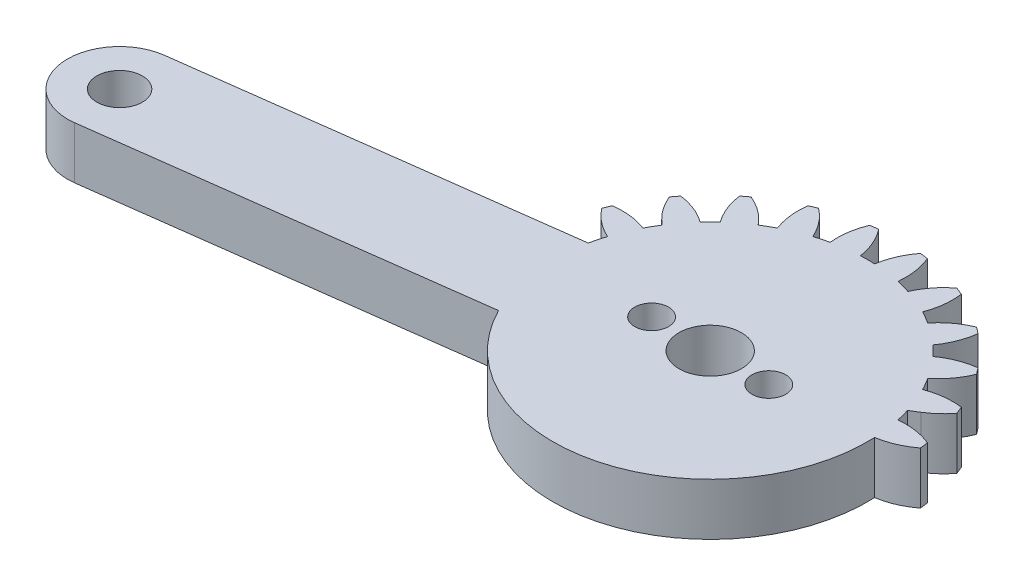
from build123d import *

# Parameters (mm, degrees)
SKETCH1_R           = 1.75
SKETCH1_R_2         = 2.4
SKETCH1_R_3         = 1.3
BOSS_EXTRUDE1_DEPTH = 4


with BuildPart() as part:
    # Sketch1 → Boss-Extrude1 (new body)
    with BuildSketch(Plane(origin=(0, 4, 0), x_dir=(1, 0, 0), z_dir=(0, 1, 0))):
        with BuildLine():
            Line((1.43808022, 3.600125745), (2.081641936, 4))
            ThreePointArc((2.081641936, 4), (2.861028333, 4.588201733), (3.521749436, 5.30713988))
            ThreePointArc((3.521749436, 5.30713988), (3.405395609, 5.596745198), (3.282888305, 5.883801663))
            ThreePointArc((3.282888305, 5.883801663), (1.93527598, 5.894040025), (0.627094961, 5.57027124))
            ThreePointArc((0.627094961, 5.57027124), (0.366286148, 6.046375), (0.084372603, 6.510293938))
            ThreePointArc((0.084372603, 6.510293938), (1.018855105, 7.48132754), (1.683794586, 8.65351323))
            ThreePointArc((1.683794586, 8.65351323), (1.496450048, 8.903135899), (1.303821399, 9.148703928))
            ThreePointArc((1.303821399, 9.148703928), (-0.000522033, 8.809805691), (-1.180330337, 8.158486898))
            ThreePointArc((-1.180330337, 8.158486898), (-1.555477026, 8.550865528), (-1.947855656, 8.926012217))
            ThreePointArc((-1.947855656, 8.926012217), (-1.296536862, 10.105820521), (-0.957638625, 11.410163953))
            ThreePointArc((-0.957638625, 11.410163953), (-1.203206655, 11.602792602), (-1.452829324, 11.79013714))
            ThreePointArc((-1.452829324, 11.79013714), (-2.625015014, 11.125197659), (-3.596048616, 10.190715157))
            ThreePointArc((-3.596048616, 10.190715157), (-4.059967554, 10.472628702), (-4.536071314, 10.733437515))
            ThreePointArc((-4.536071314, 10.733437515), (-4.212302529, 12.041618533), (-4.222540891, 13.389230859))
            ThreePointArc((-4.222540891, 13.389230859), (-4.509597355, 13.511738163), (-4.799202674, 13.62809199))
            ThreePointArc((-4.799202674, 13.62809199), (-5.759348103, 12.682425791), (-6.455432668, 11.528463019))
            ThreePointArc((-6.455432668, 11.528463019), (-6.976508546, 11.680699536), (-7.503891752, 11.809396783))
            ThreePointArc((-7.503891752, 11.809396783), (-7.529737283, 13.156800143), (-7.888414517, 14.455843809))
            ThreePointArc((-7.888414517, 14.455843809), (-8.197396993, 14.499881098), (-8.507248835, 14.537314892))
            ThreePointArc((-8.507248835, 14.537314892), (-9.18992168, 13.375367565), (-9.563620196, 12.080565177))
            ThreePointArc((-9.563620196, 12.080565177), (-10.106342554, 12.09275), (-10.649064912, 12.080565177))
            ThreePointArc((-10.649064912, 12.080565177), (-11.022763428, 13.375367565), (-11.705436272, 14.537314892))
            ThreePointArc((-11.705436272, 14.537314892), (-12.015288115, 14.499881098), (-12.324270591, 14.455843809))
            ThreePointArc((-12.324270591, 14.455843809), (-12.682947825, 13.156800143), (-12.708793355, 11.809396783))
            ThreePointArc((-12.708793355, 11.809396783), (-13.236176561, 11.680699536), (-13.757252439, 11.528463019))
            ThreePointArc((-13.757252439, 11.528463019), (-14.453337005, 12.682425791), (-15.413482434, 13.62809199))
            ThreePointArc((-15.413482434, 13.62809199), (-15.703087752, 13.511738163), (-15.990144217, 13.389230859))
            ThreePointArc((-15.990144217, 13.389230859), (-16.000382579, 12.041618533), (-15.676613793, 10.733437515))
            ThreePointArc((-15.676613793, 10.733437515), (-16.152717554, 10.472628702), (-16.616636492, 10.190715157))
            ThreePointArc((-16.616636492, 10.190715157), (-17.587670094, 11.125197659), (-18.759855783, 11.79013714))
            ThreePointArc((-18.759855783, 11.79013714), (-19.009478453, 11.602792602), (-19.255046482, 11.410163953))
            ThreePointArc((-19.255046482, 11.410163953), (-18.916148245, 10.105820521), (-18.264829452, 8.926012217))
            ThreePointArc((-18.264829452, 8.926012217), (-18.657208082, 8.550865528), (-19.032354771, 8.158486898))
            ThreePointArc((-19.032354771, 8.158486898), (-20.212163074, 8.809805691), (-21.516506507, 9.148703928))
            ThreePointArc((-21.516506507, 9.148703928), (-21.709135156, 8.903135899), (-21.896479694, 8.65351323))
            ThreePointArc((-21.896479694, 8.65351323), (-21.231540213, 7.48132754), (-20.297057711, 6.510293938))
            ThreePointArc((-20.297057711, 6.510293938), (-20.578971255, 6.046375), (-20.839780068, 5.57027124))
            ThreePointArc((-20.839780068, 5.57027124), (-22.147961087, 5.894040025), (-23.495573413, 5.883801663))
            ThreePointArc((-23.495573413, 5.883801663), (-23.618080717, 5.596745198), (-23.734434544, 5.30713988))
            ThreePointArc((-23.734434544, 5.30713988), (-22.788768345, 4.346994451), (-21.634805572, 3.650909885))
            ThreePointArc((-21.634805572, 3.650909885), (-21.803584999, 3.067429176), (-21.942853375, 2.47620963))
            Line((-21.942853375, 2.47620963), (-50.694754355, -1.309049944))
            ThreePointArc((-50.694754355, -1.309049944), (-54.138429032, -5.796934159), (-49.650544818, -9.240608835))
            Line((-49.650544818, -9.240608835), (-20.898643838, -5.455349261))
            ThreePointArc((-20.898643838, -5.455349261), (-7.038913378, -11.697242445), (1.974222624, 0.542722358))
            ThreePointArc((1.974222624, 0.542722358), (3.269025011, 0.916420874), (4.430972339, 1.599093719))
            ThreePointArc((4.430972339, 1.599093719), (4.393538544, 1.908945561), (4.349501255, 2.217928037))
            ThreePointArc((4.349501255, 2.217928037), (3.050457589, 2.576605271), (1.70305423, 2.602450802))
            ThreePointArc((1.70305423, 2.602450802), (1.581217534, 3.104116905), (1.43808022, 3.600125745))
        make_face()
        with Locations(Location((-50.172649586, -5.27482939, 0), (0, 0, 90))):
            Circle(SKETCH1_R, mode=Mode.SUBTRACT)
        with Locations(Location((-10.106342554, 0, 0), (0, 0, 90))):
            Circle(SKETCH1_R_2, mode=Mode.SUBTRACT)
        with Locations(Location((-5.606342554, 0, 0), (0, 0, 90))):
            Circle(SKETCH1_R_3, mode=Mode.SUBTRACT)
        with Locations(Location((-14.606342554, 0, 0), (0, 0, 90))):
            Circle(SKETCH1_R_3, mode=Mode.SUBTRACT)
    extrude(amount=-BOSS_EXTRUDE1_DEPTH)


solid = part.part
